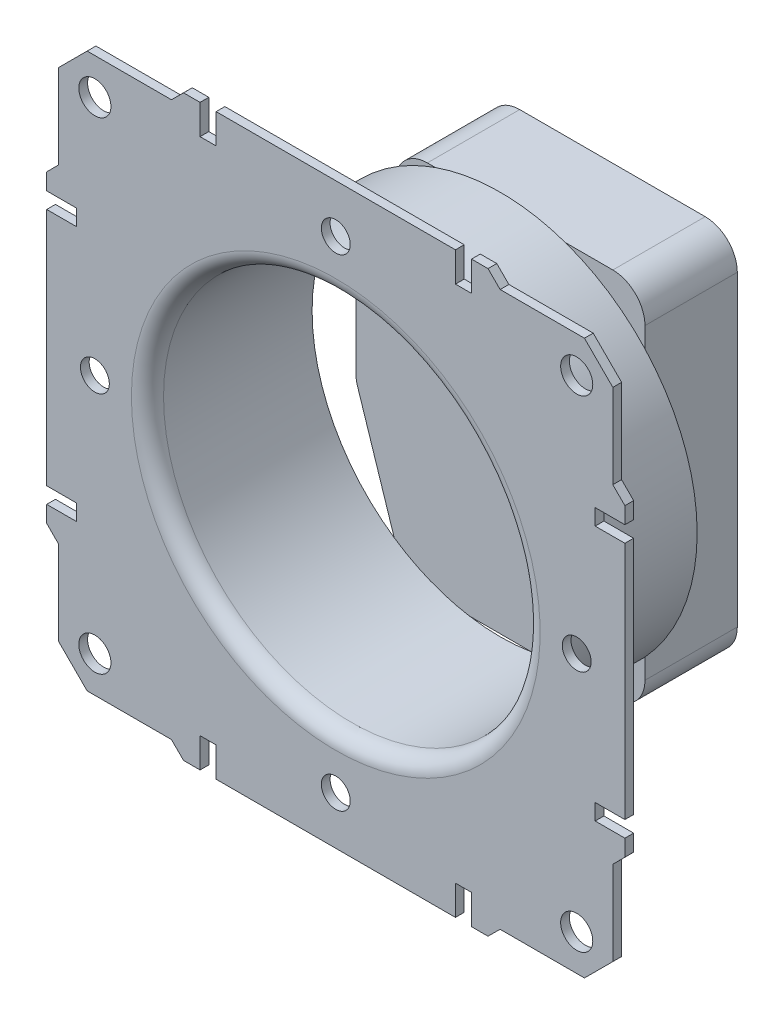
from build123d import *

# Parameters (mm, degrees)
SKETCH_1_R      = 2
SKETCH_1_R_2    = 1.8
SKETCH_1_R_3    = 23.45
EXTRUDE_1_DEPTH = 1.09
EXTRUDE_START   = -20.5
SKETCH_2_R      = 24.5
SKETCH_2_R_2    = 23.45
EXTRUDE_2_DEPTH = 20.5
FILLET_1_R      = 2
SKETCH_3_R      = 1.5
EXTRUDE_3_DEPTH = 11.5


with BuildPart() as part:
    # Эскиз1 → Бобышка-Вытянуть1 (new body)
    with BuildSketch(Plane.XY):
        Polygon((-30.964466094, 34.5), (-34.5, 30.964466094), (-34.5, 20.464466094), (-36, 18.956328052), (-36, 16.901005102), (-32.3, 16.901005102), (-32.3, 14.901005102), (-36, 14.901005102), (-36, -14.901005102), (-32.3, -14.901005102), (-32.3, -16.901005102), (-36, -16.901005102), (-36, -18.956328052), (-34.5, -20.464466094), (-34.5, -30.964466094), (-30.964466094, -34.5), (-20.464466094, -34.5), (-18.956328052, -36), (-16.901005102, -36), (-16.901005102, -32.3), (-14.901005102, -32.3), (-14.901005102, -36), (14.901005102, -36), (14.901005102, -32.3), (16.901005102, -32.3), (16.901005102, -36), (18.956328052, -36), (20.464466094, -34.5), (30.964466094, -34.5), (34.5, -30.964466094), (34.5, -20.464466094), (36, -18.956328052), (36, -16.901005102), (32.3, -16.901005102), (32.3, -14.901005102), (36, -14.901005102), (36, 14.901005102), (32.3, 14.901005102), (32.3, 16.901005102), (36, 16.901005102), (36, 18.956328052), (34.5, 20.464466094), (34.5, 30.964466094), (30.964466094, 34.5), (20.464466094, 34.5), (18.956328052, 36), (16.901005102, 36), (16.901005102, 32.3), (14.901005102, 32.3), (14.901005102, 36), (-14.901005102, 36), (-14.901005102, 32.3), (-16.901005102, 32.3), (-16.901005102, 36), (-18.956328052, 36), (-20.464466094, 34.5), align=None)
        with Locations((-30, 30)):
            Circle(SKETCH_1_R, mode=Mode.SUBTRACT)
        with Locations((-30, 0)):
            Circle(SKETCH_1_R_2, mode=Mode.SUBTRACT)
        with Locations((30, 30)):
            Circle(SKETCH_1_R, mode=Mode.SUBTRACT)
        with Locations((0, 30)):
            Circle(SKETCH_1_R_2, mode=Mode.SUBTRACT)
        with Locations((30, -30)):
            Circle(SKETCH_1_R, mode=Mode.SUBTRACT)
        with Locations((30, 0)):
            Circle(SKETCH_1_R_2, mode=Mode.SUBTRACT)
        with Locations((-30, -30)):
            Circle(SKETCH_1_R, mode=Mode.SUBTRACT)
        with Locations((0, -30)):
            Circle(SKETCH_1_R_2, mode=Mode.SUBTRACT)
        Circle(SKETCH_1_R_3, mode=Mode.SUBTRACT)
    extrude(amount=EXTRUDE_1_DEPTH)

    # Эскиз2 → Бобышка-Вытянуть2 (add)
    with BuildSketch(Plane.XY.offset(1.09).offset(EXTRUDE_START)):
        Circle(SKETCH_2_R)
        Circle(SKETCH_2_R_2, mode=Mode.SUBTRACT)
    extrude(amount=EXTRUDE_2_DEPTH)

    # Скругление1
    fillet_1_edges = [part.edges().sort_by_distance(p)[0] for p in [
        (-23.45, 0, 1.09),
        (-24.5, 0, 0),
    ]]
    fillet(fillet_1_edges, radius=FILLET_1_R)

    # Эскиз3 → Бобышка-Вытянуть3 (add)
    with BuildSketch(Plane(origin=(0, 0, -19.41), x_dir=(-1, 0, 0), z_dir=(0, 0, -1))):
        with BuildLine():
            Line((-18, -19.125), (-18, 19.125))
            ThreePointArc((-18, 19.125), (-16.828427125, 21.953427125), (-14, 23.125))
            Line((-14, 23.125), (9.094464209, 23.125))
            ThreePointArc((9.094464209, 23.125), (11.445269302, 22.361312008), (12.898433585, 20.361857708))
            Line((12.898433585, 20.361857708), (17.803969376, 5.274828861))
            ThreePointArc((17.803969376, 5.274828861), (17.95068839, 4.664119098), (18, 4.037971153))
            Line((18, 4.037971153), (18, -4.037971153))
            ThreePointArc((18, -4.037971153), (17.95068839, -4.664119098), (17.803969376, -5.274828861))
            Line((17.803969376, -5.274828861), (12.898433585, -20.361857708))
            ThreePointArc((12.898433585, -20.361857708), (11.445269302, -22.361312008), (9.094464209, -23.125))
            Line((9.094464209, -23.125), (-14, -23.125))
            ThreePointArc((-14, -23.125), (-16.828427125, -21.953427125), (-18, -19.125))
        make_face()
        Circle(SKETCH_3_R, mode=Mode.SUBTRACT)
    extrude(amount=EXTRUDE_3_DEPTH)


solid = part.part
